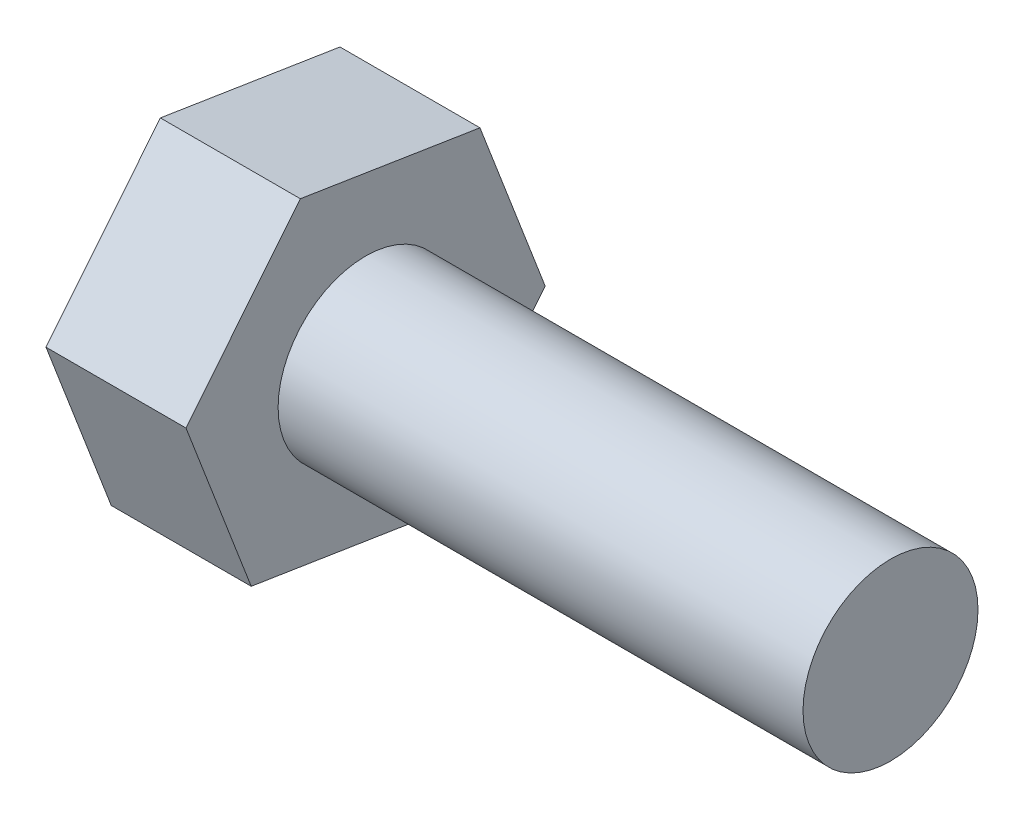
from build123d import *

# Parameters (mm, degrees)
SKETCH_1_R      = 5
EXTRUDE_1_DEPTH = 30
EXTRUDE_2_DEPTH = 8


with BuildPart() as part:
    # Эскиз1 → Вытянуть1 (new body)
    with BuildSketch(Plane(origin=(0, 0, 0), x_dir=(0, 0, -1), z_dir=(1, 0, 0))):
        Circle(SKETCH_1_R)
    extrude(amount=EXTRUDE_1_DEPTH)

    # Эскиз2 → Вытянуть2 (add)
    with BuildSketch(Plane.ZY):
        Polygon((10.26515369, 1.620684952), (3.729022505, 9.700226346), (-6.536131185, 8.079541393), (-10.26515369, -1.620684952), (-3.729022505, -9.700226346), (6.536131185, -8.079541393), align=None)
    extrude(amount=EXTRUDE_2_DEPTH)


solid = part.part
